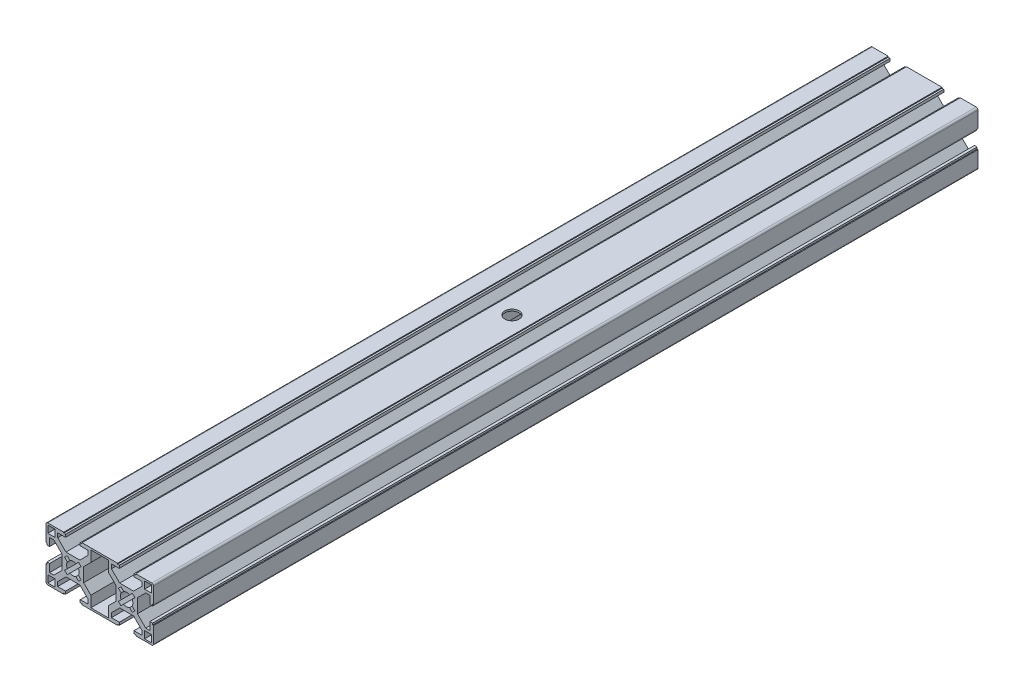
from build123d import *

# Parameters (mm, degrees)
ESBO_O1_W                      = 4
ESBO_O1_H                      = 4
RESSALTO_EXTRUS_O1_DEPTH       = 460
PADR_OCIRCULAR1_COUNT          = 4
PADR_O_LINEAR1_COUNT           = 2
PADR_O_LINEAR1_PITCH           = 30
PADR_O_LINEAR1_COPY_1_SKETCH_W = 4
PADR_O_LINEAR1_COPY_1_SKETCH_H = 4
PADR_O_LINEAR1_COPY_1_DEPTH    = 460
PADR_O_LINEAR1_COPY_2_SKETCH_W = 4
PADR_O_LINEAR1_COPY_2_SKETCH_H = 4
PADR_O_LINEAR1_COPY_2_DEPTH    = 460
PADR_O_LINEAR1_COPY_3_SKETCH_W = 4
PADR_O_LINEAR1_COPY_3_SKETCH_H = 4
PADR_O_LINEAR1_COPY_3_DEPTH    = 460
ESBO_O4_W                      = 10
ESBO_O4_H                      = 28
CORTE_EXTRUS_O1_DEPTH          = 463.439185191
FILETE1_R                      = 1
ESBO_O5_R                      = 4
CORTE_EXTRUS_O2_DEPTH          = 464.168435885


with BuildPart() as part:
    # Esboço1 → Ressalto-extrusão1 (new body)
    with BuildSketch(Plane.XY):
        with BuildLine():
            ThreePointArc((-1.664601464, 3.078815026), (-0.858529967, 3.393070335), (0, 3.5))
            Line((0, 3.5), (0, 6))
            Line((0, 6), (-3.878679656, 6))
            Line((-3.878679656, 6), (-8.5, 10.621320344))
            Line((-8.5, 10.621320344), (-8.5, 13))
            Line((-8.5, 13), (-4.1, 13))
            Line((-4.1, 13), (-4.1, 14.5))
            Line((-4.1, 14.5), (-5.1, 14.5))
            Line((-5.1, 14.5), (-5.1, 15))
            Line((-5.1, 15), (-15, 15))
            Line((-15, 15), (-15, 5.1))
            Line((-15, 5.1), (-14.5, 5.1))
            Line((-14.5, 5.1), (-14.5, 4.1))
            Line((-14.5, 4.1), (-13, 4.1))
            Line((-13, 4.1), (-13, 8.5))
            Line((-13, 8.5), (-10.621320344, 8.5))
            Line((-10.621320344, 8.5), (-6, 3.878679656))
            Line((-6, 3.878679656), (-6, 0))
            Line((-6, 0), (-3.5, 0))
            ThreePointArc((-3.5, 0), (-3.393070335, 0.858529967), (-3.078815026, 1.664601464))
            Line((-3.078815026, 1.664601464), (-4.596194078, 3.181980515))
            Line((-4.596194078, 3.181980515), (-3.181980515, 4.596194078))
            Line((-3.181980515, 4.596194078), (-1.664601464, 3.078815026))
        make_face()
        with Locations((-12, 12)):
            Rectangle(ESBO_O1_W, ESBO_O1_H, mode=Mode.SUBTRACT)
    ressalto_extrus_o1 = extrude(amount=RESSALTO_EXTRUS_O1_DEPTH)

    # PadrãoCircular1: Ressalto-extrusão1 ×4 about axis
    padr_ocircular1_axis = Axis((0, 0, 0), (0, 0, 1))
    for i in range(1, PADR_OCIRCULAR1_COUNT):
        add(ressalto_extrus_o1.rotate(padr_ocircular1_axis, i * 360 / PADR_OCIRCULAR1_COUNT))

    # Padrão linear1: Ressalto-extrusão1 ×2
    with Locations(*[(i * PADR_O_LINEAR1_PITCH, 0, 0) for i in range(1, PADR_O_LINEAR1_COUNT)]):
        add(ressalto_extrus_o1)

    # Padrão linear1 copy 1 sketch → Padrão linear1 copy 1 (add)
    with BuildSketch(Plane(origin=(30, 0, 0), x_dir=(0, 1, 0), z_dir=(0, 0, 1))):
        with BuildLine():
            ThreePointArc((-1.664601464, 3.078815026), (-0.858529967, 3.393070335), (0, 3.5))
            Line((0, 3.5), (0, 6))
            Line((0, 6), (-3.878679656, 6))
            Line((-3.878679656, 6), (-8.5, 10.621320344))
            Line((-8.5, 10.621320344), (-8.5, 13))
            Line((-8.5, 13), (-4.1, 13))
            Line((-4.1, 13), (-4.1, 14.5))
            Line((-4.1, 14.5), (-5.1, 14.5))
            Line((-5.1, 14.5), (-5.1, 15))
            Line((-5.1, 15), (-15, 15))
            Line((-15, 15), (-15, 5.1))
            Line((-15, 5.1), (-14.5, 5.1))
            Line((-14.5, 5.1), (-14.5, 4.1))
            Line((-14.5, 4.1), (-13, 4.1))
            Line((-13, 4.1), (-13, 8.5))
            Line((-13, 8.5), (-10.621320344, 8.5))
            Line((-10.621320344, 8.5), (-6, 3.878679656))
            Line((-6, 3.878679656), (-6, 0))
            Line((-6, 0), (-3.5, 0))
            ThreePointArc((-3.5, 0), (-3.393070335, 0.858529967), (-3.078815026, 1.664601464))
            Line((-3.078815026, 1.664601464), (-4.596194078, 3.181980515))
            Line((-4.596194078, 3.181980515), (-3.181980515, 4.596194078))
            Line((-3.181980515, 4.596194078), (-1.664601464, 3.078815026))
        make_face()
        with Locations((-12, 12)):
            Rectangle(PADR_O_LINEAR1_COPY_1_SKETCH_W, PADR_O_LINEAR1_COPY_1_SKETCH_H, mode=Mode.SUBTRACT)
    extrude(amount=PADR_O_LINEAR1_COPY_1_DEPTH)

    # Padrão linear1 copy 2 sketch → Padrão linear1 copy 2 (add)
    with BuildSketch(Plane(origin=(30, 0, 0), x_dir=(-1, 0, 0), z_dir=(0, 0, 1))):
        with BuildLine():
            ThreePointArc((-1.664601464, 3.078815026), (-0.858529967, 3.393070335), (0, 3.5))
            Line((0, 3.5), (0, 6))
            Line((0, 6), (-3.878679656, 6))
            Line((-3.878679656, 6), (-8.5, 10.621320344))
            Line((-8.5, 10.621320344), (-8.5, 13))
            Line((-8.5, 13), (-4.1, 13))
            Line((-4.1, 13), (-4.1, 14.5))
            Line((-4.1, 14.5), (-5.1, 14.5))
            Line((-5.1, 14.5), (-5.1, 15))
            Line((-5.1, 15), (-15, 15))
            Line((-15, 15), (-15, 5.1))
            Line((-15, 5.1), (-14.5, 5.1))
            Line((-14.5, 5.1), (-14.5, 4.1))
            Line((-14.5, 4.1), (-13, 4.1))
            Line((-13, 4.1), (-13, 8.5))
            Line((-13, 8.5), (-10.621320344, 8.5))
            Line((-10.621320344, 8.5), (-6, 3.878679656))
            Line((-6, 3.878679656), (-6, 0))
            Line((-6, 0), (-3.5, 0))
            ThreePointArc((-3.5, 0), (-3.393070335, 0.858529967), (-3.078815026, 1.664601464))
            Line((-3.078815026, 1.664601464), (-4.596194078, 3.181980515))
            Line((-4.596194078, 3.181980515), (-3.181980515, 4.596194078))
            Line((-3.181980515, 4.596194078), (-1.664601464, 3.078815026))
        make_face()
        with Locations((-12, 12)):
            Rectangle(PADR_O_LINEAR1_COPY_2_SKETCH_W, PADR_O_LINEAR1_COPY_2_SKETCH_H, mode=Mode.SUBTRACT)
    extrude(amount=PADR_O_LINEAR1_COPY_2_DEPTH)

    # Padrão linear1 copy 3 sketch → Padrão linear1 copy 3 (add)
    with BuildSketch(Plane(origin=(30, 0, 0), x_dir=(0, -1, 0), z_dir=(0, 0, 1))):
        with BuildLine():
            ThreePointArc((-1.664601464, 3.078815026), (-0.858529967, 3.393070335), (0, 3.5))
            Line((0, 3.5), (0, 6))
            Line((0, 6), (-3.878679656, 6))
            Line((-3.878679656, 6), (-8.5, 10.621320344))
            Line((-8.5, 10.621320344), (-8.5, 13))
            Line((-8.5, 13), (-4.1, 13))
            Line((-4.1, 13), (-4.1, 14.5))
            Line((-4.1, 14.5), (-5.1, 14.5))
            Line((-5.1, 14.5), (-5.1, 15))
            Line((-5.1, 15), (-15, 15))
            Line((-15, 15), (-15, 5.1))
            Line((-15, 5.1), (-14.5, 5.1))
            Line((-14.5, 5.1), (-14.5, 4.1))
            Line((-14.5, 4.1), (-13, 4.1))
            Line((-13, 4.1), (-13, 8.5))
            Line((-13, 8.5), (-10.621320344, 8.5))
            Line((-10.621320344, 8.5), (-6, 3.878679656))
            Line((-6, 3.878679656), (-6, 0))
            Line((-6, 0), (-3.5, 0))
            ThreePointArc((-3.5, 0), (-3.393070335, 0.858529967), (-3.078815026, 1.664601464))
            Line((-3.078815026, 1.664601464), (-4.596194078, 3.181980515))
            Line((-4.596194078, 3.181980515), (-3.181980515, 4.596194078))
            Line((-3.181980515, 4.596194078), (-1.664601464, 3.078815026))
        make_face()
        with Locations((-12, 12)):
            Rectangle(PADR_O_LINEAR1_COPY_3_SKETCH_W, PADR_O_LINEAR1_COPY_3_SKETCH_H, mode=Mode.SUBTRACT)
    extrude(amount=PADR_O_LINEAR1_COPY_3_DEPTH)

    # Esboço4 → Corte-extrusão1 (cut, through all)
    with BuildSketch(Plane(origin=(0, 0, 0), x_dir=(-1, 0, 0), z_dir=(0, 0, -1))):
        with Locations((-15, 0)):
            Rectangle(ESBO_O4_W, ESBO_O4_H)
    extrude(amount=-CORTE_EXTRUS_O1_DEPTH, mode=Mode.SUBTRACT)

    # Filete1
    filete1_edges = [part.edges().sort_by_distance(p)[0] for p in [
        (45, -15, 230),
        (45, 15, 230),
        (-15, 15, 230),
        (-15, -15, 230),
    ]]
    fillet(filete1_edges, radius=FILETE1_R)

    # Esboço5 → Corte-extrusão2 (cut, through all)
    with BuildSketch(Plane(origin=(0, 15, 0), x_dir=(1, 0, 0), z_dir=(0, 1, 0))):
        with Locations(Location((15, -230, 0), (0, 0, 180))):
            Circle(ESBO_O5_R)
    extrude(amount=-CORTE_EXTRUS_O2_DEPTH, mode=Mode.SUBTRACT)


solid = part.part
